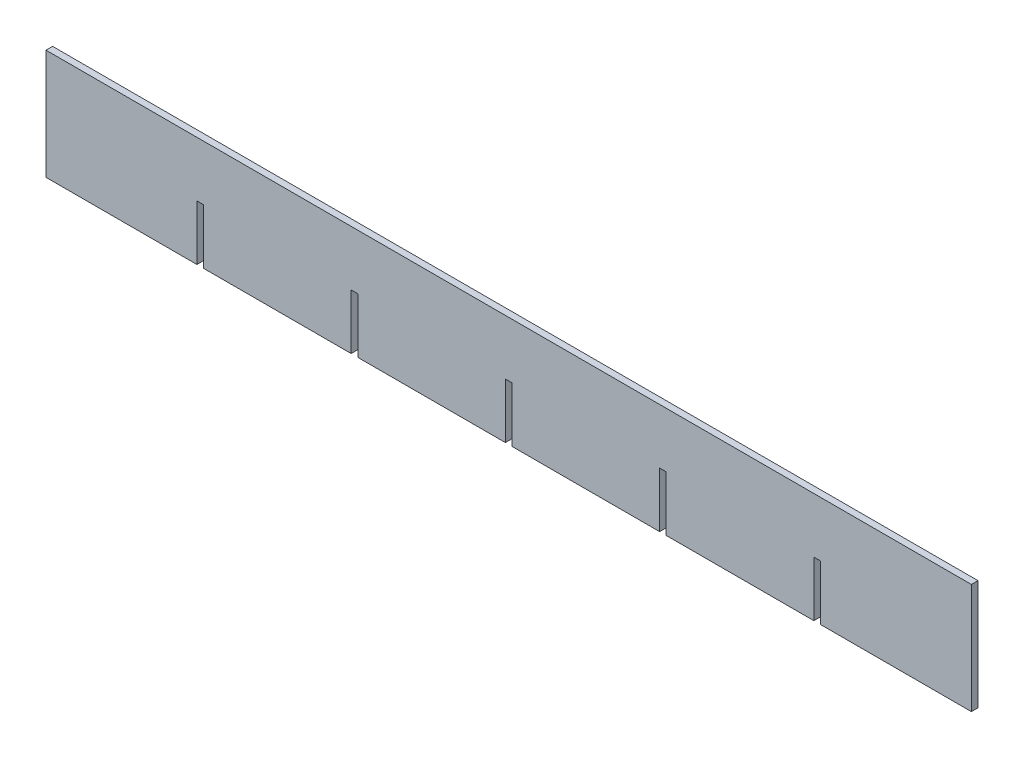
from build123d import *

# Parameters (mm, degrees)
BOSS_EXTRUDE1_DEPTH = 3


with BuildPart() as part:
    # Sketch1 → Boss-Extrude1 (new body)
    with BuildSketch(Plane.XY):
        Polygon((0, 50), (0, 0), (68.5, 0), (68.5, 25), (71.5, 25), (71.5, 0), (138.5, 0), (138.5, 25), (141.5, 25), (141.5, 0), (208.5, 0), (208.5, 25), (211.5, 25), (211.5, 0), (278.5, 0), (278.5, 25), (281.5, 25), (281.5, 0), (348.5, 0), (348.5, 25), (351.5, 25), (351.5, 0), (420, 0), (420, 50), align=None)
    extrude(amount=BOSS_EXTRUDE1_DEPTH)


solid = part.part
